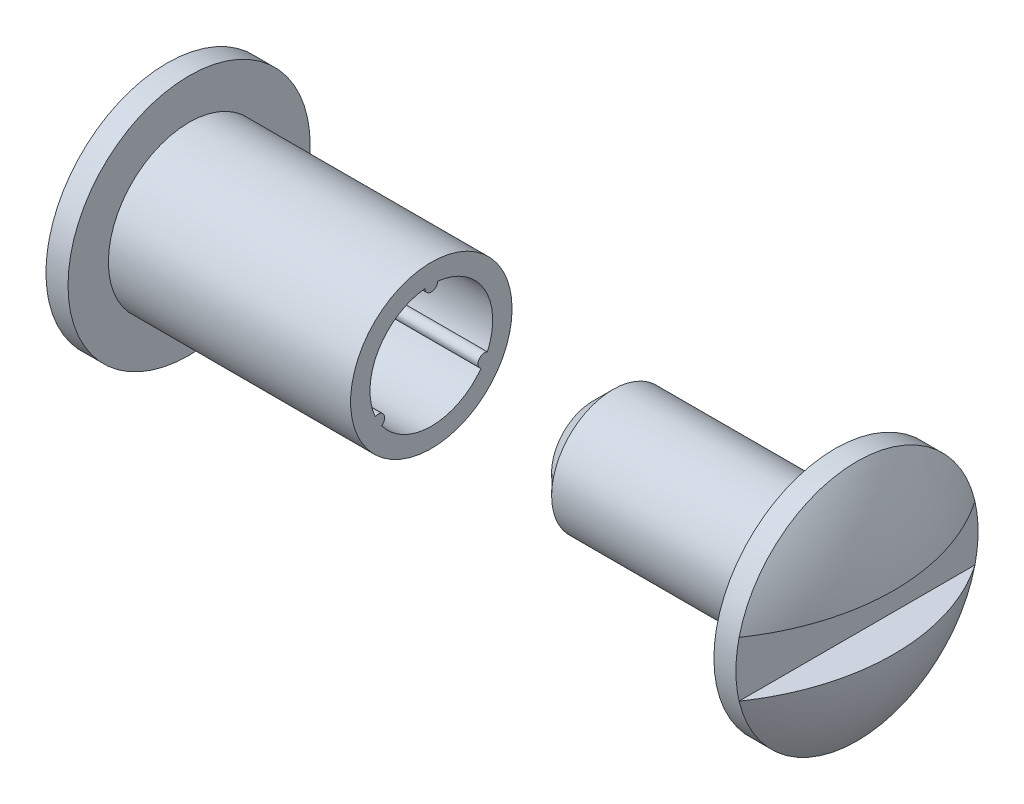
from build123d import *

# Parameters (mm, degrees)
SKETCH2_R           = 2.413
BOSS_EXTRUDE1_DEPTH = 9.525
CHAMFER1_SIZE       = 0.79375
SKETCH17_W          = 9.525
SKETCH17_H          = 2.1717
CUT_EXTRUDE5_DEPTH  = 1.514533
BOSS_EXTRUDE3_REACH = 21.39
SKETCH11_R          = 3.175


with BuildPart() as part:
    # Sketch2 → Boss-Extrude1 (new body)
    with BuildSketch(Plane(origin=(0, 0, 0), x_dir=(0, 0, -1), z_dir=(1, 0, 0))):
        with Locations(Location((0, 0, 0), (0, 0, 180))):
            Circle(SKETCH2_R)
    extrude(amount=BOSS_EXTRUDE1_DEPTH)

    # Chamfer1
    chamfer1_edges = [part.edges().sort_by_distance(p)[0] for p in [
        (0, 0, -2.413),
    ]]
    chamfer(chamfer1_edges, length=CHAMFER1_SIZE)


with BuildPart() as body_2:
    # Sketch6 → Revolve1 (revolve)
    with BuildSketch(Plane.XY):
        with BuildLine():
            Line((9.525, 0), (9.525, 4.7625))
            Line((9.525, 4.7625), (10.390447273, 4.7625))
            ThreePointArc((10.390447273, 4.7625), (11.517229345, 2.498760474), (11.90498, 0))
            Line((11.90498, 0), (9.525, 0))
        make_face()
    revolve(axis=Axis((9.525, 0, 0), (1, 0, 0)))

    # Sketch17 → Cut-Extrude5 (cut)
    with BuildSketch(Plane(origin=(11.90498, 0, 0), x_dir=(0, 0, -1), z_dir=(1, 0, 0))):
        Rectangle(SKETCH17_W, SKETCH17_H)
    extrude(amount=-CUT_EXTRUDE5_DEPTH, mode=Mode.SUBTRACT)


with BuildPart() as body_3:
    # Mirror1: mirrored copy
    add(body_2.part.mirror(Plane(origin=(-3.175, 0, 0), x_dir=(0, 0, 1), z_dir=(1, 0, 0))))


with BuildPart() as body_4:

    # Sketch11 → Boss-Extrude3 (new, up to next)
    with BuildSketch(Plane(origin=(-6.35, 0, 0), x_dir=(0, 0, -1), z_dir=(1, 0, 0)), mode=Mode.PRIVATE) as boss_extrude3_sk1:
        Circle(SKETCH11_R)
        with BuildLine():
            ThreePointArc((-0.253647955, 2.399631579), (-2.089719299, 1.2065), (-2.204965885, -0.980150216))
            ThreePointArc((-2.204965885, -0.980150216), (-1.869748847, -1.0795), (-1.951317929, -1.419481363))
            ThreePointArc((-1.951317929, -1.419481363), (0, -2.413), (1.951317929, -1.419481363))
            ThreePointArc((1.951317929, -1.419481363), (1.869748847, -1.0795), (2.204965885, -0.980150216))
            ThreePointArc((2.204965885, -0.980150216), (2.089719299, 1.2065), (0.253647955, 2.399631579))
            ThreePointArc((0.253647955, 2.399631579), (0, 2.159), (-0.253647955, 2.399631579))
        make_face(mode=Mode.SUBTRACT)
    boss_extrude3_tool1 = extrude(boss_extrude3_sk1.sketch, amount=-BOSS_EXTRUDE3_REACH, mode=Mode.PRIVATE) - body_3.part
    add(boss_extrude3_tool1.solids().sort_by_distance((-6.35, 0, 3.085197))[0])

    # Combine1: union body 3
    add(body_3.part)


with BuildPart() as body_2_1:
    add(body_2.part)

    # Combine2: union part
    add(part.part)


solid = Compound([body_4.part, body_2_1.part])
